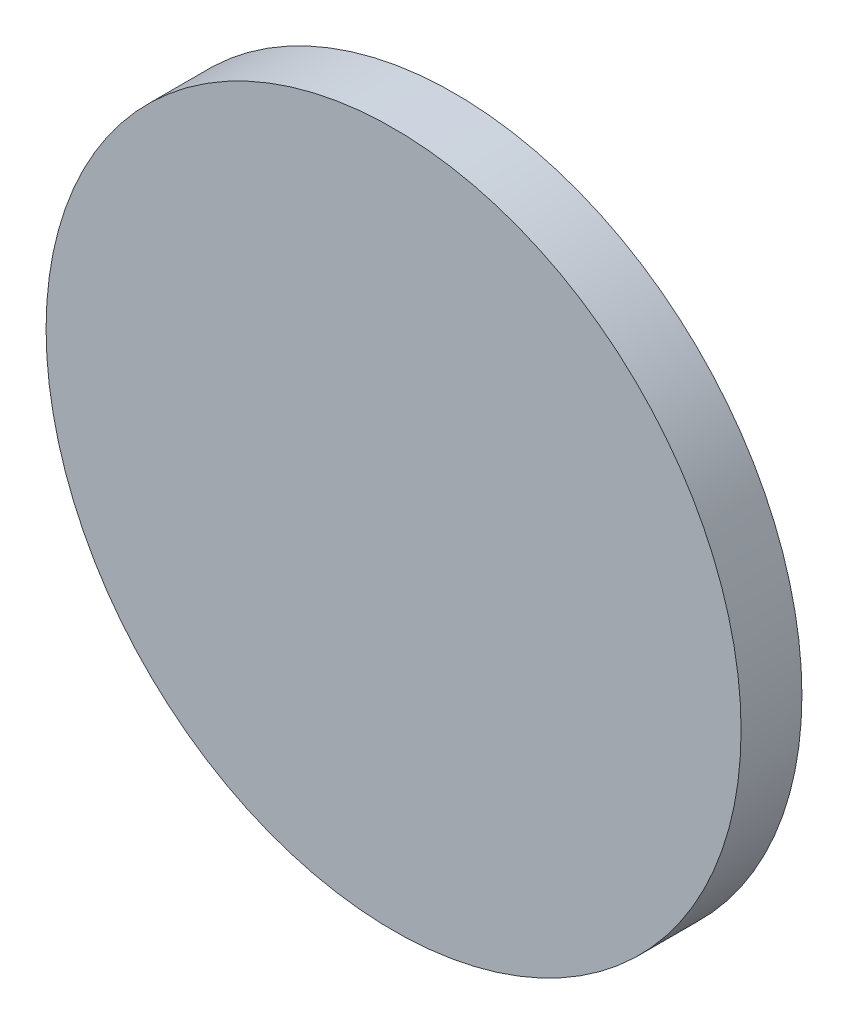
from build123d import *

# Parameters (mm, degrees)
SKETCH1_R           = 57.116275093
BOSS_EXTRUDE1_DEPTH = 10


with BuildPart() as part:
    # Sketch1 → Boss-Extrude1 (new body)
    with BuildSketch(Plane.XY):
        Circle(SKETCH1_R)
    extrude(amount=BOSS_EXTRUDE1_DEPTH)


solid = part.part
